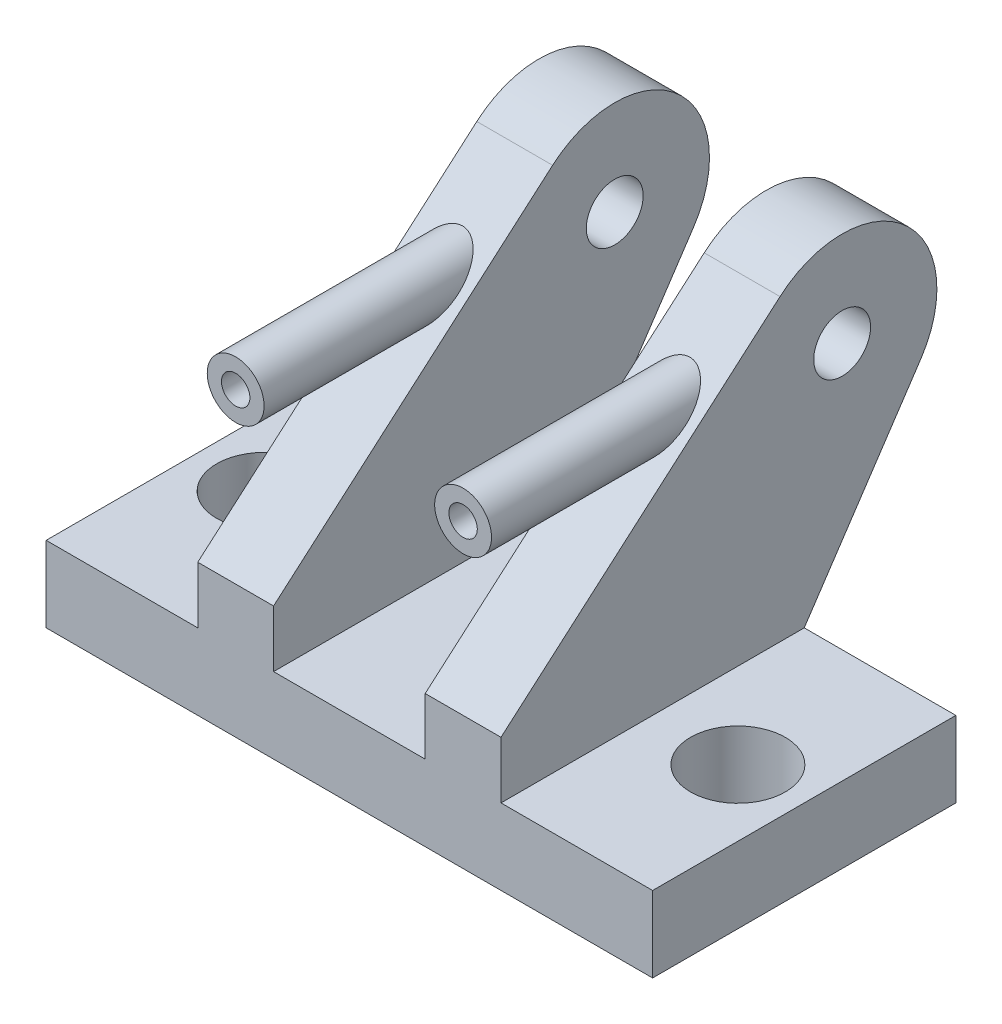
from build123d import *

# Parameters (mm, degrees)
SKETCH_1_W               = 64
SKETCH_1_H               = 32
EXTRUDE_1_DEPTH          = 8
EXTRUDE_START            = 8
SKETCH_2_R               = 3
EXTRUDE_2_DEPTH          = 8
EXTRUDE_3_REACH          = 72.029
SKETCH_3_R               = 3
CUT_EXTRUDE_1_REACH      = 72.029
CUT_EXTRUDE_1_END_RADIUS = 3
SKETCH_4_R               = 1.5
CUT_EXTRUDE_START        = -8
SKETCH_5_R               = 5
CUT_EXTRUDE_3_DEPTH      = 69.728905803


with BuildPart() as part:
    # 草图1 → 凸台-拉伸1 (new body)
    with BuildSketch(Plane(origin=(0, 0, 0), x_dir=(1, 0, 0), z_dir=(0, 1, 0))):
        Rectangle(SKETCH_1_W, SKETCH_1_H)
    extrude(amount=EXTRUDE_1_DEPTH)

    # 草图2 → 凸台-拉伸2 (add)
    with BuildSketch(Plane(origin=(0, 0, 0), x_dir=(0, 0, -1), z_dir=(1, 0, 0)).offset(EXTRUDE_START)):
        with BuildLine():
            Line((-16, 8), (-16, 14))
            Line((-16, 14), (13.44586918, 39.552706084))
            ThreePointArc((13.44586918, 39.552706084), (26.611734227, 39.502331005), (28.316651221, 26.447224796))
            Line((28.316651221, 26.447224796), (16, 8))
            Line((16, 8), (-16, 8))
        make_face()
        with Locations((20, 32)):
            Circle(SKETCH_2_R, mode=Mode.SUBTRACT)
    extrude_2 = extrude(amount=EXTRUDE_2_DEPTH)

    # 凸台-拉伸3: up to this plane
    extrude_3_end = Plane(origin=(16, 14, 16), z_dir=(0, -0.7552706084274633, -0.6554130819915097))
    # 草图3 → 凸台-拉伸3 (add, up to the surface)
    with BuildSketch(Plane.XY.offset(16), mode=Mode.PRIVATE) as extrude_3_sk1:
        with Locations((12, 31.770444903)):
            Circle(SKETCH_3_R)
    extrude_3_tool1 = split(extrude(extrude_3_sk1.sketch, amount=-EXTRUDE_3_REACH, mode=Mode.PRIVATE), bisect_by=extrude_3_end, keep=Keep.BOTH, mode=Mode.PRIVATE)
    extrude_3 = extrude_3_tool1.solids().sort_by_distance((12, 31.770445, 16))[0]
    add(extrude_3)

    # 切除-拉伸1: up to this cylinder (the profile starts outside it)
    cut_extrude_1_end = Plane(origin=(12, 32, -20), z_dir=(-1, 0, 0)) * Cylinder(CUT_EXTRUDE_1_END_RADIUS, 151.058, mode=Mode.PRIVATE)
    # 草图4 → 切除-拉伸1 (cut, up to the surface)
    with BuildSketch(Plane.XY.offset(16), mode=Mode.PRIVATE) as cut_extrude_1_sk1:
        with Locations((12, 31.770444903)):
            Circle(SKETCH_4_R)
    cut_extrude_1_tool1 = extrude(cut_extrude_1_sk1.sketch, amount=-CUT_EXTRUDE_1_REACH, mode=Mode.PRIVATE) - cut_extrude_1_end
    cut_extrude_1 = cut_extrude_1_tool1.solids().sort_by_distance((12, 31.770445, 16))[0]
    add(cut_extrude_1, mode=Mode.SUBTRACT)

    # 镜向1: 凸台-拉伸2, 凸台-拉伸3, 切除-拉伸1 across plane
    add(extrude_2.mirror(Plane(origin=(0, 0, 0), x_dir=(0, 0, 1), z_dir=(1, 0, 0))))
    add(extrude_3.mirror(Plane(origin=(0, 0, 0), x_dir=(0, 0, 1), z_dir=(1, 0, 0))))
    add(cut_extrude_1.mirror(Plane(origin=(0, 0, 0), x_dir=(0, 0, 1), z_dir=(1, 0, 0))), mode=Mode.SUBTRACT)

    # 草图5 → 切除-拉伸3 (cut)
    with BuildSketch(Plane(origin=(0, 0, 0), x_dir=(1, 0, 0), z_dir=(0, 1, 0)).offset(CUT_EXTRUDE_START)):
        with Locations(Location((-25, 0, 0), (0, 0, 270))):
            Circle(SKETCH_5_R)
    cut_extrude_3 = extrude(amount=CUT_EXTRUDE_3_DEPTH, mode=Mode.SUBTRACT)

    # 镜向2: 切除-拉伸3 across plane
    add(cut_extrude_3.mirror(Plane(origin=(0, 0, 0), x_dir=(0, 0, 1), z_dir=(1, 0, 0))), mode=Mode.SUBTRACT)


solid = part.part
